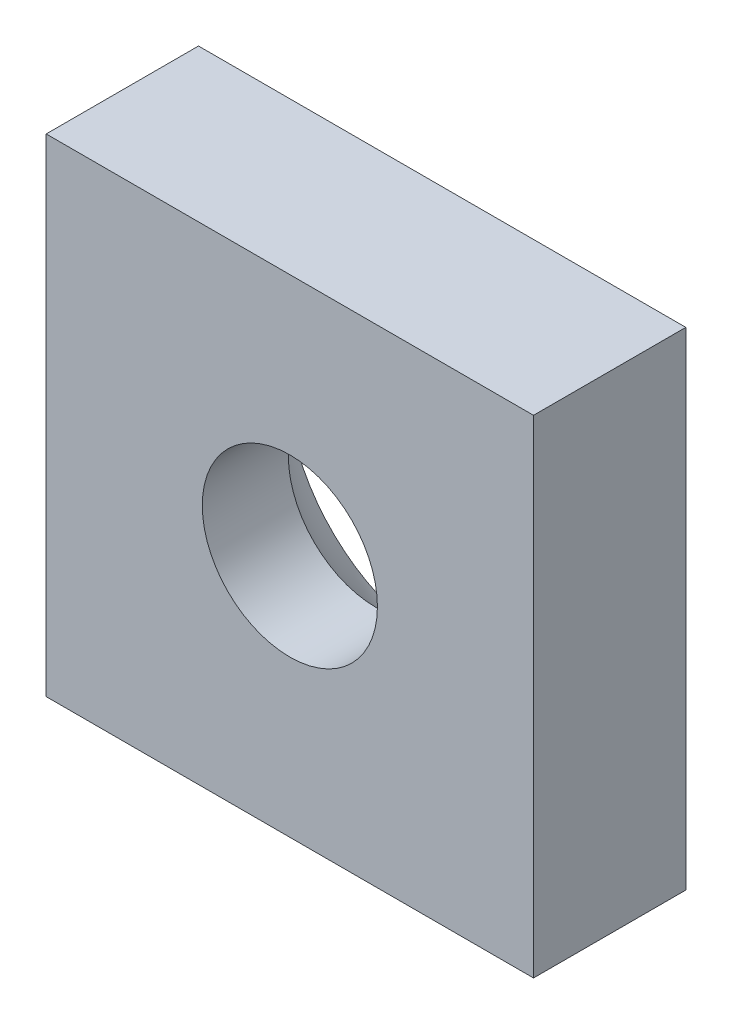
from build123d import *

# Parameters (mm, degrees)
SKETCH3_W      = 15.875
SKETCH3_H      = 50.8
EXTRUDE2_DEPTH = 25.4


with BuildPart() as part:
    # Sketch3 → Extrude2 (new, symmetric)
    with BuildSketch(Plane(origin=(0, 0, 0), x_dir=(0, 0, -1), z_dir=(1, 0, 0))):
        with Locations((-17.4625, 0)):
            Rectangle(SKETCH3_W, SKETCH3_H)
    extrude(amount=EXTRUDE2_DEPTH, both=True)

    # Sketch4 → Cut-Revolve2 (revolve, cut)
    with BuildSketch(Plane(origin=(0, 0, 0), x_dir=(0, 0, -1), z_dir=(1, 0, 0))):
        with BuildLine():
            Line((-34.061608779, 0), (0, 0))
            Line((0, 0), (0, 18.796))
            ThreePointArc((0, 18.796), (-9.531982441, 16.199719959), (-16.430671014, 9.128125))
            Line((-16.430671014, 9.128125), (-34.061608779, 9.128125))
            Line((-34.061608779, 9.128125), (-34.061608779, 0))
        make_face()
    revolve(axis=Axis((0, 0, 0), (0, 0, -1)), mode=Mode.SUBTRACT)


solid = part.part
